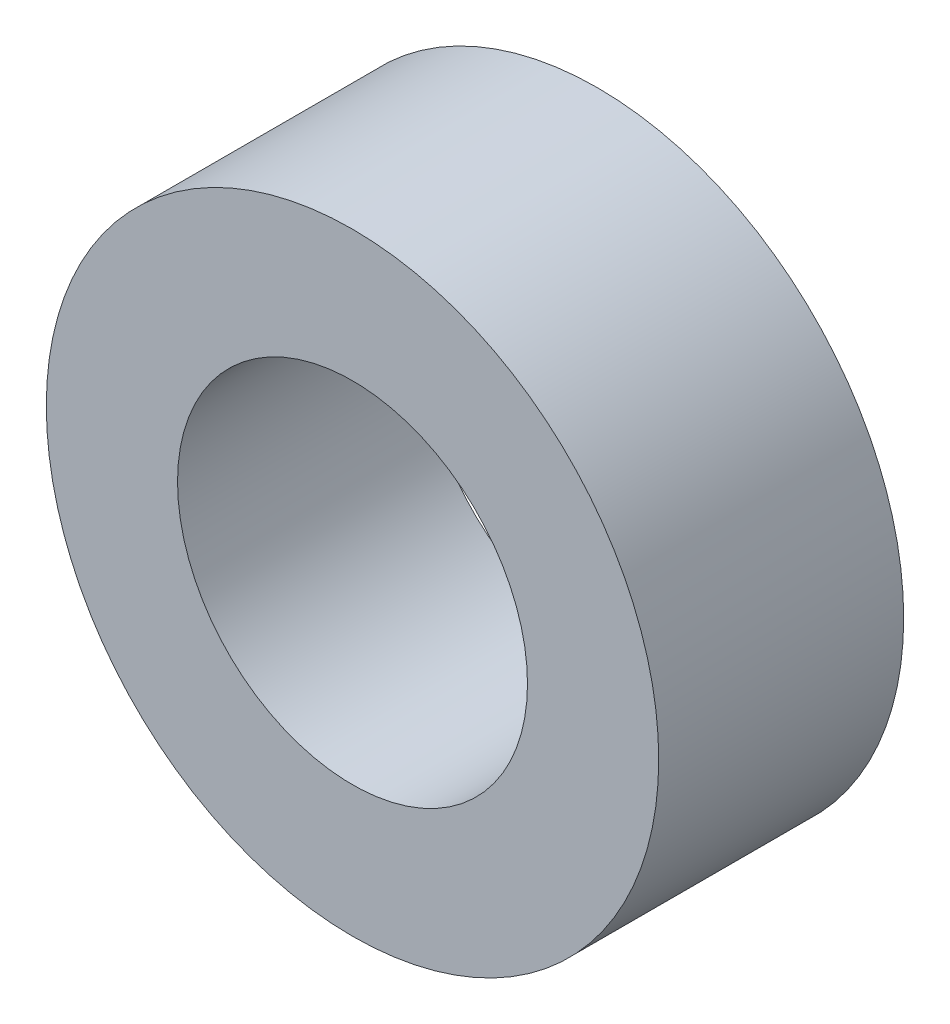
from build123d import *

# Parameters (mm, degrees)
SKETCH1_R           = 17.5
SKETCH1_R_2         = 10
BOSS_EXTRUDE1_DEPTH = 14


with BuildPart() as part:
    # Sketch1 → Boss-Extrude1 (new body)
    with BuildSketch(Plane.XY):
        with Locations((0.403421843, -40.066663422)):
            Circle(SKETCH1_R)
        with Locations((0.403421843, -40.066663422)):
            Circle(SKETCH1_R_2, mode=Mode.SUBTRACT)
    extrude(amount=BOSS_EXTRUDE1_DEPTH)


solid = part.part
